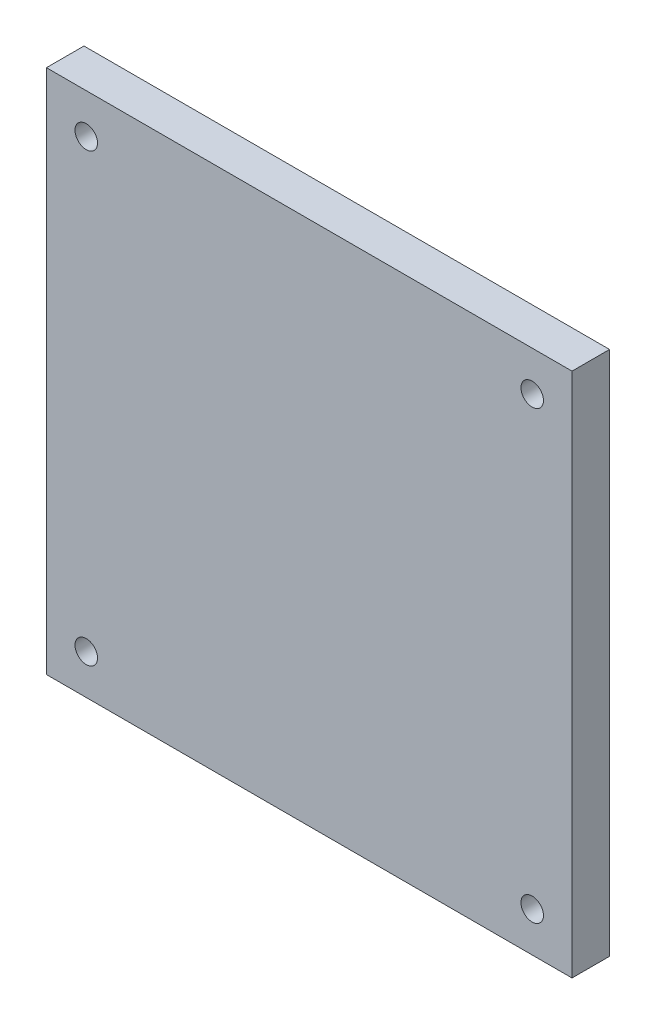
from build123d import *

# Parameters (mm, degrees)
SKETCH_1_W          = 70
SKETCH_1_H          = 70
EXTRUDE_1_DEPTH     = 5
SKETCH_2_R          = 1.5
CUT_EXTRUDE_1_DEPTH = 5


with BuildPart() as part:
    # Эскиз1 → Бобышка-Вытянуть1 (new body)
    with BuildSketch(Plane.XY):
        Rectangle(SKETCH_1_W, SKETCH_1_H)
    extrude(amount=EXTRUDE_1_DEPTH)

    # Эскиз2 → Вырез-Вытянуть1 (cut)
    with BuildSketch(Plane.XY.offset(5)):
        with Locations((-29.696699141, 29.696699141)):
            Circle(SKETCH_2_R)
        with Locations((29.696699141, 29.696699141)):
            Circle(SKETCH_2_R)
        with Locations((29.696699141, -29.696699141)):
            Circle(SKETCH_2_R)
        with Locations((-29.696699141, -29.696699141)):
            Circle(SKETCH_2_R)
    extrude(amount=-CUT_EXTRUDE_1_DEPTH, mode=Mode.SUBTRACT)


solid = part.part
